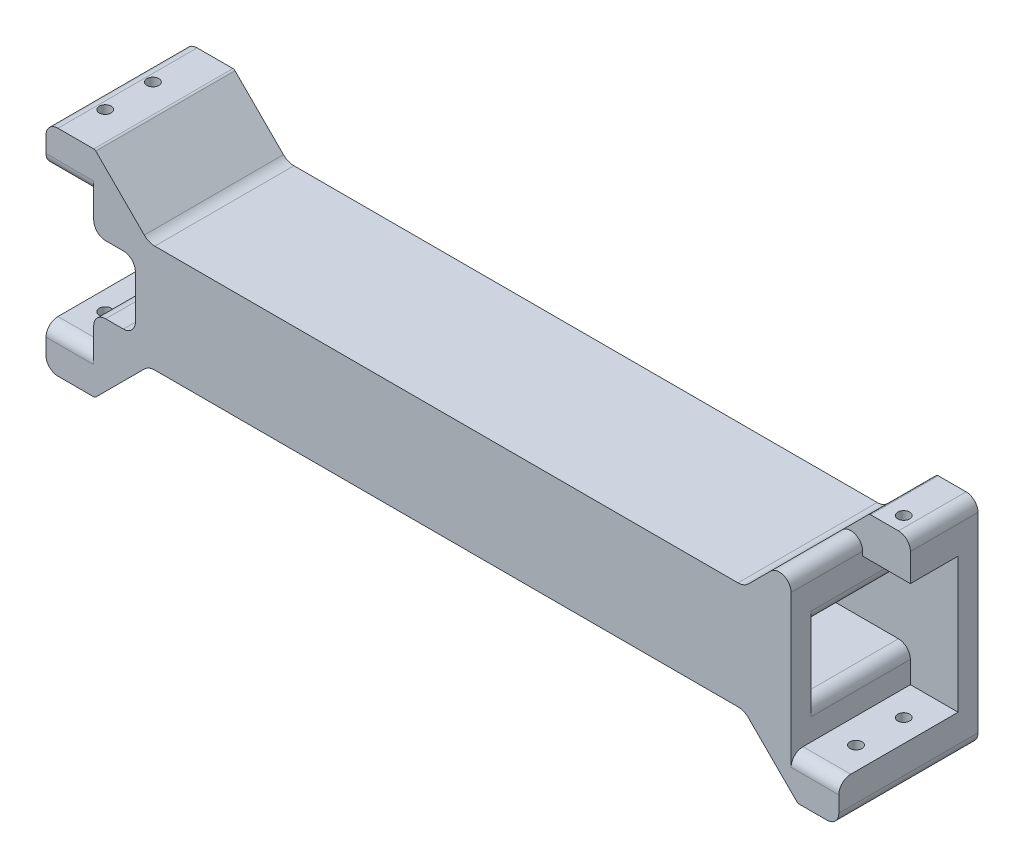
from build123d import *

# Parameters (mm, degrees)
EXTRUDE_1_DEPTH          = 35
SKETCH_2_W               = 25
SKETCH_2_H               = 17
CUT_EXTRUDE_1_DEPTH      = 211.274969583
SKETCH_3_W               = 25
SKETCH_3_H               = 8.5
CUT_EXTRUDE_2_DEPTH      = 12
FILLET_1_R               = 3
CUT_EXTRUDE_3_DEPTH      = 246.07389189
CUT_EXTRUDE_3_DEPTH_BACK = 246.07389189
SKETCH_4_R               = 1.5
CUT_EXTRUDE_4_DEPTH      = 10
FILLET_2_R               = 3
SKETCH_7_W               = 12
SKETCH_7_H               = 3
CUT_EXTRUDE_6_DEPTH      = 18
FILLET_3_R               = 3
CUT_EXTRUDE_8_DEPTH      = 10
FILLET_4_R               = 3
SKETCH_9_R               = 1.5
CUT_EXTRUDE_9_DEPTH      = 8
CUT_EXTRUDE_10_DEPTH     = 8
FILLET_5_R               = 3


with BuildPart() as part:
    # 草图1 → 凸台-拉伸1 (new body)
    with BuildSketch(Plane.XY):
        with BuildLine():
            Line((49.121689234, 57), (37.121689234, 57))
            Line((37.121689234, 57), (37.121689234, 3))
            Line((37.121689234, 3), (49.121689234, 3))
            ThreePointArc((49.121689234, 3), (49.40357385, 3.056070336), (49.642544089, 3.215745145))
            Line((49.642544089, 3.215745145), (61.832374142, 15.405575199))
            ThreePointArc((61.832374142, 15.405575199), (63.044614428, 16.215568261), (64.474549341, 16.5))
            Line((64.474549341, 16.5), (211.121689234, 16.5))
            ThreePointArc((211.121689234, 16.5), (212.551624147, 16.215568261), (213.763864432, 15.405575199))
            Line((213.763864432, 15.405575199), (225.953694486, 3.215745145))
            ThreePointArc((225.953694486, 3.215745145), (226.192664725, 3.056070336), (226.474549341, 3))
            Line((226.474549341, 3), (236.474549341, 3))
            Line((236.474549341, 3), (236.474549341, 57))
            Line((236.474549341, 57), (226.474549341, 57))
            ThreePointArc((226.474549341, 57), (226.192664725, 56.943929664), (225.953694486, 56.784254855))
            Line((225.953694486, 56.784254855), (213.763864432, 44.594424801))
            ThreePointArc((213.763864432, 44.594424801), (212.551624147, 43.784431739), (211.121689234, 43.5))
            Line((211.121689234, 43.5), (64.474549341, 43.5))
            ThreePointArc((64.474549341, 43.5), (63.044614428, 43.784431739), (61.832374142, 44.594424801))
            Line((61.832374142, 44.594424801), (49.642544089, 56.784254855))
            ThreePointArc((49.642544089, 56.784254855), (49.40357385, 56.943929664), (49.121689234, 57))
        make_face()
    extrude(amount=-EXTRUDE_1_DEPTH)

    # 草图2 → 切除-拉伸1 (cut, through all)
    with BuildSketch(Plane.ZY.offset(-37.121689234)):
        with Locations((-17.5, 30)):
            Rectangle(SKETCH_2_W, SKETCH_2_H)
    extrude(amount=-CUT_EXTRUDE_1_DEPTH, mode=Mode.SUBTRACT)

    # 草图3 → 切除-拉伸2 (cut)
    with BuildSketch(Plane.ZY.offset(-37.121689234)):
        with Locations((-17.5, 42.75)):
            Rectangle(SKETCH_3_W, SKETCH_3_H)
        with Locations((-17.5, 17.25)):
            Rectangle(SKETCH_3_W, SKETCH_3_H)
    cut_extrude_2 = extrude(amount=-CUT_EXTRUDE_2_DEPTH, mode=Mode.SUBTRACT)

    # 镜向1: 切除-拉伸2 across plane
    add(cut_extrude_2.mirror(Plane.ZY.offset(-136.798119287)), mode=Mode.SUBTRACT)

    # 圆角1
    fillet_1_edges = [part.edges().sort_by_distance(p)[0] for p in [
        (224.474549341, 38.5, -17.5),
        (224.474549341, 21.5, -17.5),
        (37.121689234, 3, -17.5),
        (37.121689234, 57, -17.5),
        (236.474549341, 57, -17.5),
        (236.474549341, 3, -17.5),
        (49.121689234, 38.5, -17.5),
        (49.121689234, 21.5, -17.5),
    ]]
    fillet(fillet_1_edges, radius=FILLET_1_R)

    # 草图4 → 切除-拉伸3 (cut, two sides: drawn at the far end of the back side and taken through both)
    with BuildSketch(Plane(origin=(0, 57, 0), x_dir=(1, 0, 0), z_dir=(0, 1, 0)).offset(-CUT_EXTRUDE_3_DEPTH_BACK)):
        with Locations(Location((42, 22, 0), (0, 0, 180))):
            Circle(SKETCH_4_R)
        with Locations(Location((42, 10, 0), (0, 0, 180))):
            Circle(SKETCH_4_R)
        with Locations(Location((230.798119287, 22, 0), (0, 0, 180))):
            Circle(SKETCH_4_R)
        with Locations(Location((230.798119287, 10, 0), (0, 0, 180))):
            Circle(SKETCH_4_R)
    extrude(amount=CUT_EXTRUDE_3_DEPTH + CUT_EXTRUDE_3_DEPTH_BACK, mode=Mode.SUBTRACT)

    # 草图5 → 切除-拉伸4 (cut)
    with BuildSketch(Plane(origin=(0, 0, -5), x_dir=(-1, 0, 0), z_dir=(0, 0, -1))):
        Polygon((-224.474549341, 41.5), (-224.474549341, 18.5), (-224.474549341, 13), (-236.474549341, 13), (-236.474549341, 47), (-224.474549341, 47), align=None)
        Polygon((-49.121689234, 41.5), (-49.121689234, 18.5), (-49.121689234, 13), (-37.121689234, 13), (-37.121689234, 47), (-49.121689234, 47), align=None)
    extrude(amount=-CUT_EXTRUDE_4_DEPTH, mode=Mode.SUBTRACT)

    # 圆角2
    fillet_2_edges = [part.edges().sort_by_distance(p)[0] for p in [
        (230.474549341, 13, 0),
        (230.474549341, 47, 0),
        (43.121689234, 47, 0),
        (43.121689234, 13, 0),
    ]]
    fillet(fillet_2_edges, radius=FILLET_2_R)

    # 草图7 → 切除-拉伸6 (cut)
    with BuildSketch(Plane.XY):
        with Locations((230.474549341, 48.5)):
            Rectangle(SKETCH_7_W, SKETCH_7_H)
        with BuildLine():
            Line((224.474549341, 50), (236.474549341, 50))
            Line((236.474549341, 50), (236.474549341, 54))
            ThreePointArc((236.474549341, 54), (235.595869685, 56.121320344), (233.474549341, 57))
            Line((233.474549341, 57), (226.474549341, 57))
            ThreePointArc((226.474549341, 57), (226.192664725, 56.943929664), (225.953694486, 56.784254855))
            Line((225.953694486, 56.784254855), (224.474549341, 55.30510971))
            Line((224.474549341, 55.30510971), (224.474549341, 50))
        make_face()
    extrude(amount=-CUT_EXTRUDE_6_DEPTH, mode=Mode.SUBTRACT)

    # 圆角3
    fillet_3_edges = [part.edges().sort_by_distance(p)[0] for p in [
        (224.474549341, 55.30510971, -9),
    ]]
    fillet(fillet_3_edges, radius=FILLET_3_R)

    # 草图8 → 切除-拉伸8 (cut)
    with BuildSketch(Plane.XY.offset(-30)):
        Polygon((49.121689234, 41.5), (49.121689234, 18.5), (49.121689234, 13), (37.121689234, 13), (37.121689234, 47), (49.121689234, 47), align=None)
    extrude(amount=-CUT_EXTRUDE_8_DEPTH, mode=Mode.SUBTRACT)

    # 圆角4
    fillet_4_edges = [part.edges().sort_by_distance(p)[0] for p in [
        (43.121689234, 13, -35),
        (43.121689234, 47, -35),
    ]]
    fillet(fillet_4_edges, radius=FILLET_4_R)

    # 草图9 → 切除-拉伸9 (cut)
    with BuildSketch(Plane(origin=(0, 0, -35), x_dir=(-1, 0, 0), z_dir=(0, 0, -1))):
        with Locations((-55.191240802, 25)):
            Circle(SKETCH_9_R)
        with Locations((-55.191240802, 35)):
            Circle(SKETCH_9_R)
    extrude(amount=-CUT_EXTRUDE_9_DEPTH, mode=Mode.SUBTRACT)

    # 草图10 → 切除-拉伸10 (cut)
    with BuildSketch(Plane(origin=(0, 0, -5), x_dir=(-1, 0, 0), z_dir=(0, 0, -1))):
        with BuildLine():
            Line((-52.121689234, 38.5), (-59.586907824, 38.5))
            Line((-59.586907824, 38.5), (-59.586907824, 21.5))
            Line((-59.586907824, 21.5), (-52.121689234, 21.5))
            ThreePointArc((-52.121689234, 21.5), (-50.00036889, 20.621320344), (-49.121689234, 18.5))
            Line((-49.121689234, 18.5), (-49.121689234, 41.5))
            ThreePointArc((-49.121689234, 41.5), (-50.00036889, 39.378679656), (-52.121689234, 38.5))
        make_face()
    extrude(amount=-CUT_EXTRUDE_10_DEPTH, mode=Mode.SUBTRACT)

    # 圆角5
    fillet_5_edges = [part.edges().sort_by_distance(p)[0] for p in [
        (59.586907824, 38.5, -2.5),
        (59.586907824, 21.5, -2.5),
    ]]
    fillet(fillet_5_edges, radius=FILLET_5_R)


solid = part.part
